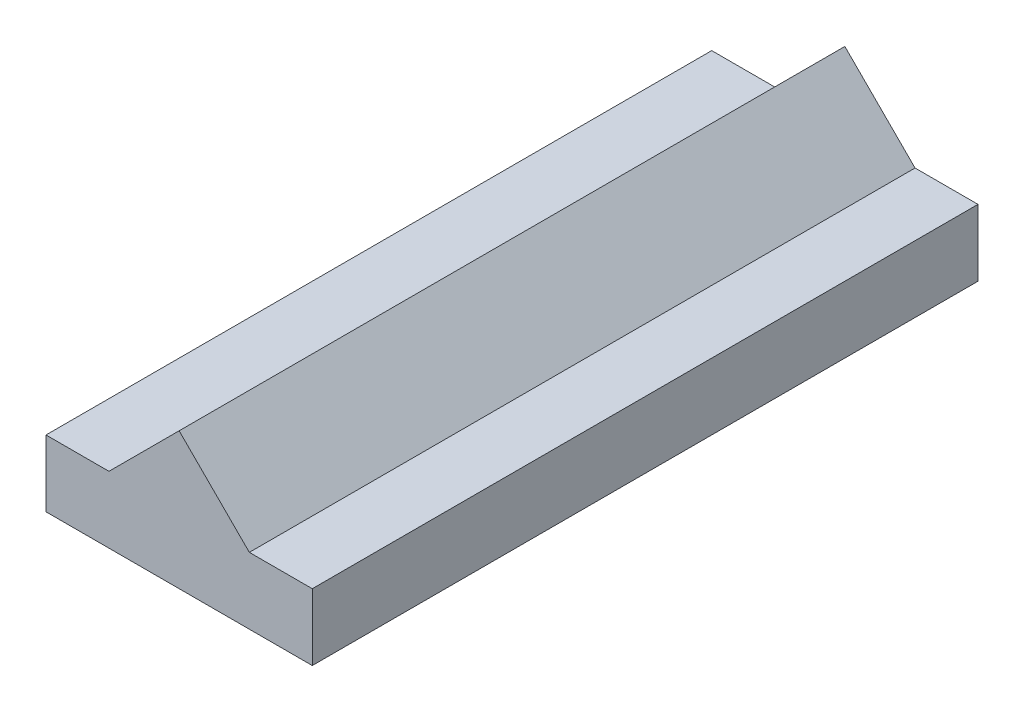
from build123d import *

# Parameters (mm, degrees)
BOSS_EXTRUDE1_DEPTH = 50


with BuildPart() as part:
    # Sketch1 → Boss-Extrude1 (new body)
    with BuildSketch(Plane.XY):
        Polygon((10, 0), (10, 5), (5.271792579, 5), (0, 10.271792579), (-5.271792579, 5), (-10, 5), (-10, 0), align=None)
    extrude(amount=BOSS_EXTRUDE1_DEPTH)


solid = part.part
